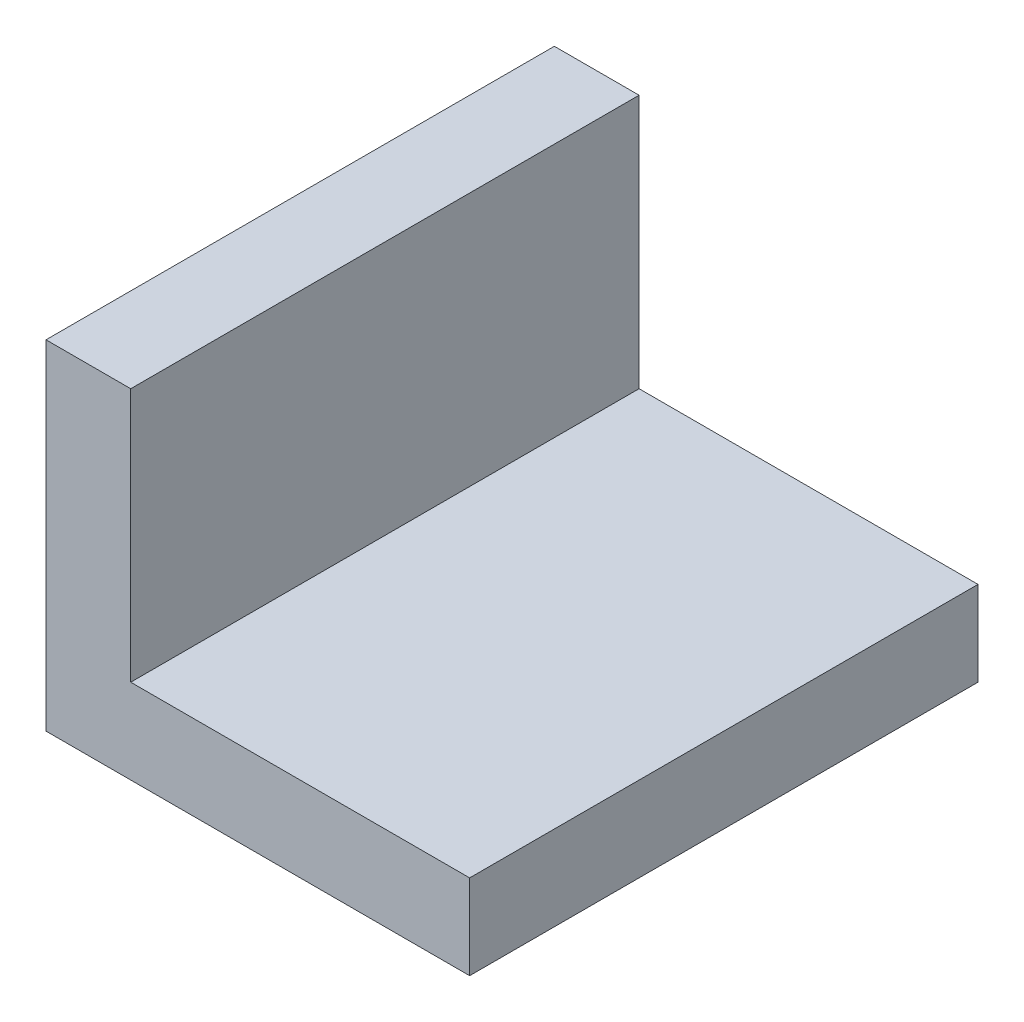
from build123d import *

# Parameters (mm, degrees)
BOSS_EXTRU_1_DEPTH = 18


with BuildPart() as part:
    # Esquisse1 → Boss.-Extru.1 (new body)
    with BuildSketch(Plane.XY):
        Polygon((0, 12), (0, 0), (15, 0), (15, 3), (3, 3), (3, 12), align=None)
    extrude(amount=BOSS_EXTRU_1_DEPTH)


solid = part.part
